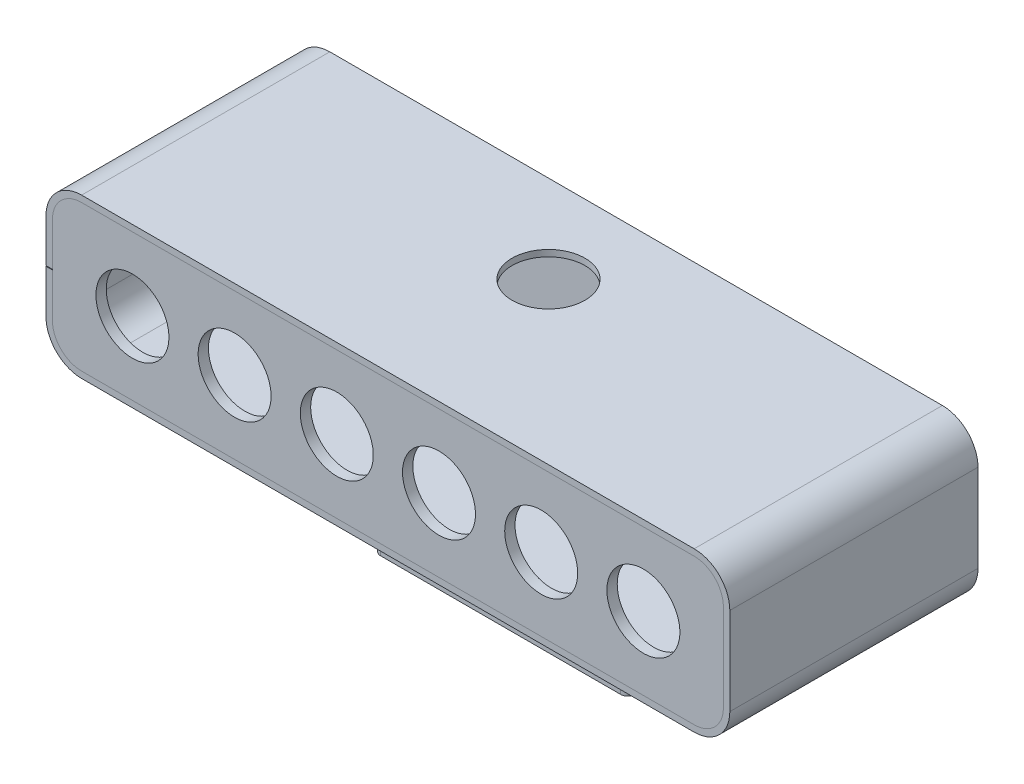
from build123d import *

# Parameters (mm, degrees)
SKETCH1_W           = 291.846
SKETCH1_H           = 63.5
BOSS_EXTRUDE1_DEPTH = 4.4958
FILLET1_R           = 12.7
BOSS_EXTRUDE2_DEPTH = 107.95
BOSS_EXTRUDE3_DEPTH = 4.4958
SKETCH2_R           = 15.875
CUT_EXTRUDE1_DEPTH  = 187.984589004
BOSS_EXTRUDE5_DEPTH = 50.8
SKETCH7_R           = 3.175
CUT_EXTRUDE2_DEPTH  = 4.4958
CUT_EXTRUDE3_DEPTH  = 2.794
CUT_EXTRUDE4_START  = -66.294
SKETCH9_R           = 15.875
CUT_EXTRUDE4_DEPTH  = 131.029967801
SKETCH10_R          = 1.74625
CUT_EXTRUDE5_DEPTH  = 2.794


with BuildPart() as part:
    # Sketch1 → Boss-Extrude1 (new body)
    with BuildSketch(Plane.XY):
        Rectangle(SKETCH1_W, SKETCH1_H)
    extrude(amount=BOSS_EXTRUDE1_DEPTH)

    # Fillet1
    fillet1_edges = [part.edges().sort_by_distance(p)[0] for p in [
        (145.923, -31.75, 2.2479),
        (-145.923, -31.75, 2.2479),
        (-145.923, 31.75, 2.2479),
        (145.923, 31.75, 2.2479),
    ]]
    fillet(fillet1_edges, radius=FILLET1_R)

    # Sketch7 → Cut-Extrude2 (cut)
    with BuildSketch(Plane(origin=(0, 0, 0), x_dir=(-1, 0, 0), z_dir=(0, 0, -1))):
        with Locations((-52.3875, 0)):
            Circle(SKETCH7_R)
        with Locations((52.3875, 0)):
            Circle(SKETCH7_R)
    extrude(amount=-CUT_EXTRUDE2_DEPTH, mode=Mode.SUBTRACT)


with BuildPart() as body_2:
    # Sketch3 → Boss-Extrude2 (new body)
    with BuildSketch(Plane.XY):
        with BuildLine():
            Line((133.223, 34.544), (-133.223, 34.544))
            ThreePointArc((-133.223, 34.544), (-144.178912468, 30.005912468), (-148.717, 19.05))
            Line((-148.717, 19.05), (-148.717, 0.254))
            Line((-148.717, 0.254), (-145.923, 0.254))
            Line((-145.923, 0.254), (-145.923, 19.05))
            ThreePointArc((-145.923, 19.05), (-142.203256121, 28.030256121), (-133.223, 31.75))
            Line((-133.223, 31.75), (133.223, 31.75))
            ThreePointArc((133.223, 31.75), (142.203256121, 28.030256121), (145.923, 19.05))
            Line((145.923, 19.05), (145.923, -19.05))
            ThreePointArc((145.923, -19.05), (142.203256121, -28.030256121), (133.223, -31.75))
            Line((133.223, -31.75), (-133.223, -31.75))
            ThreePointArc((-133.223, -31.75), (-142.203256121, -28.030256121), (-145.923, -19.05))
            Line((-145.923, -19.05), (-145.923, 0))
            Line((-145.923, 0), (-148.717, 0))
            Line((-148.717, 0), (-148.717, -19.05))
            ThreePointArc((-148.717, -19.05), (-144.178912468, -30.005912468), (-133.223, -34.544))
            Line((-133.223, -34.544), (133.223, -34.544))
            ThreePointArc((133.223, -34.544), (144.178912468, -30.005912468), (148.717, -19.05))
            Line((148.717, -19.05), (148.717, 19.05))
            ThreePointArc((148.717, 19.05), (144.178912468, 30.005912468), (133.223, 34.544))
        make_face()
    extrude(amount=BOSS_EXTRUDE2_DEPTH)

    # Sketch8 → Cut-Extrude3 (cut)
    with BuildSketch(Plane.XZ.offset(34.544)):
        with BuildLine():
            Line((-46.355, 53.594), (46.355, 53.594))
            ThreePointArc((46.355, 53.594), (49.049076836, 52.478076836), (50.165, 49.784))
            Line((50.165, 49.784), (50.165, 12.954))
            ThreePointArc((50.165, 12.954), (49.049076836, 10.259923164), (46.355, 9.144))
            Line((46.355, 9.144), (-46.355, 9.144))
            ThreePointArc((-46.355, 9.144), (-49.049076836, 10.259923164), (-50.165, 12.954))
            Line((-50.165, 12.954), (-50.165, 49.784))
            ThreePointArc((-50.165, 49.784), (-49.049076836, 52.478076836), (-46.355, 53.594))
        make_face()
    extrude(amount=-CUT_EXTRUDE3_DEPTH, mode=Mode.SUBTRACT)

    # Sketch9 → Cut-Extrude4 (cut, through all)
    with BuildSketch(Plane.XZ.offset(34.544).offset(CUT_EXTRUDE4_START)):
        with Locations((0, 38.1)):
            Circle(SKETCH9_R)
    extrude(amount=-CUT_EXTRUDE4_DEPTH, mode=Mode.SUBTRACT)

    # Sketch10 → Cut-Extrude5 (cut)
    with BuildSketch(Plane.XZ.offset(34.544)):
        with Locations((63.5, 50.8)):
            Circle(SKETCH10_R)
        with Locations((63.5, 12.7)):
            Circle(SKETCH10_R)
        with Locations((-63.5, 50.8)):
            Circle(SKETCH10_R)
        with Locations((-63.5, 12.7)):
            Circle(SKETCH10_R)
    extrude(amount=-CUT_EXTRUDE5_DEPTH, mode=Mode.SUBTRACT)


with BuildPart() as body_3:
    # Sketch4 → Boss-Extrude3 (new body)
    with BuildSketch(Plane.XY.offset(107.95)):
        with BuildLine():
            Line((-145.923, 19.05), (-145.923, -19.05))
            ThreePointArc((-145.923, -19.05), (-142.203256121, -28.030256121), (-133.223, -31.75))
            Line((-133.223, -31.75), (133.223, -31.75))
            ThreePointArc((133.223, -31.75), (142.203256121, -28.030256121), (145.923, -19.05))
            Line((145.923, -19.05), (145.923, 19.05))
            ThreePointArc((145.923, 19.05), (142.203256121, 28.030256121), (133.223, 31.75))
            Line((133.223, 31.75), (-133.223, 31.75))
            ThreePointArc((-133.223, 31.75), (-142.203256121, 28.030256121), (-145.923, 19.05))
        make_face()
    extrude(amount=-BOSS_EXTRUDE3_DEPTH)

    # Sketch2 → Cut-Extrude1 (cut, through all)
    with BuildSketch(Plane(origin=(0, 0, 0), x_dir=(-1, 0, 0), z_dir=(0, 0, -1))):
        with Locations((-111.125, 0)):
            Circle(SKETCH2_R)
        with Locations((-66.675, 0)):
            Circle(SKETCH2_R)
        with Locations((-22.225, 0)):
            Circle(SKETCH2_R)
        with Locations((22.225, 0)):
            Circle(SKETCH2_R)
        with Locations((66.675, 0)):
            Circle(SKETCH2_R)
        with Locations((111.125, 0)):
            Circle(SKETCH2_R)
    extrude(amount=-CUT_EXTRUDE1_DEPTH, mode=Mode.SUBTRACT)


with BuildPart() as body_4:
    # Sketch6 → Boss-Extrude5 (new body)
    with BuildSketch(Plane.XZ.offset(34.544)):
        with BuildLine():
            Line((-52.245, 58.928), (52.245, 58.928))
            ThreePointArc((52.245, 58.928), (54.366320344, 58.049320344), (55.245, 55.928))
            Line((55.245, 55.928), (55.245, 6.81))
            ThreePointArc((55.245, 6.81), (54.366320344, 4.688679656), (52.245, 3.81))
            Line((52.245, 3.81), (-52.245, 3.81))
            ThreePointArc((-52.245, 3.81), (-54.366320344, 4.688679656), (-55.245, 6.81))
            Line((-55.245, 6.81), (-55.245, 55.928))
            ThreePointArc((-55.245, 55.928), (-54.366320344, 58.049320344), (-52.245, 58.928))
        make_face()
        with BuildLine():
            Line((-52.705, 55.928), (-52.705, 6.81))
            ThreePointArc((-52.705, 6.81), (-52.570269119, 6.484730881), (-52.245, 6.35))
            Line((-52.245, 6.35), (52.245, 6.35))
            ThreePointArc((52.245, 6.35), (52.570269119, 6.484730881), (52.705, 6.81))
            Line((52.705, 6.81), (52.705, 55.928))
            ThreePointArc((52.705, 55.928), (52.570269119, 56.253269119), (52.245, 56.388))
            Line((52.245, 56.388), (-52.245, 56.388))
            ThreePointArc((-52.245, 56.388), (-52.570269119, 56.253269119), (-52.705, 55.928))
        make_face(mode=Mode.SUBTRACT)
    extrude(amount=BOSS_EXTRUDE5_DEPTH)


solid = Compound([part.part, body_2.part, body_3.part, body_4.part])
